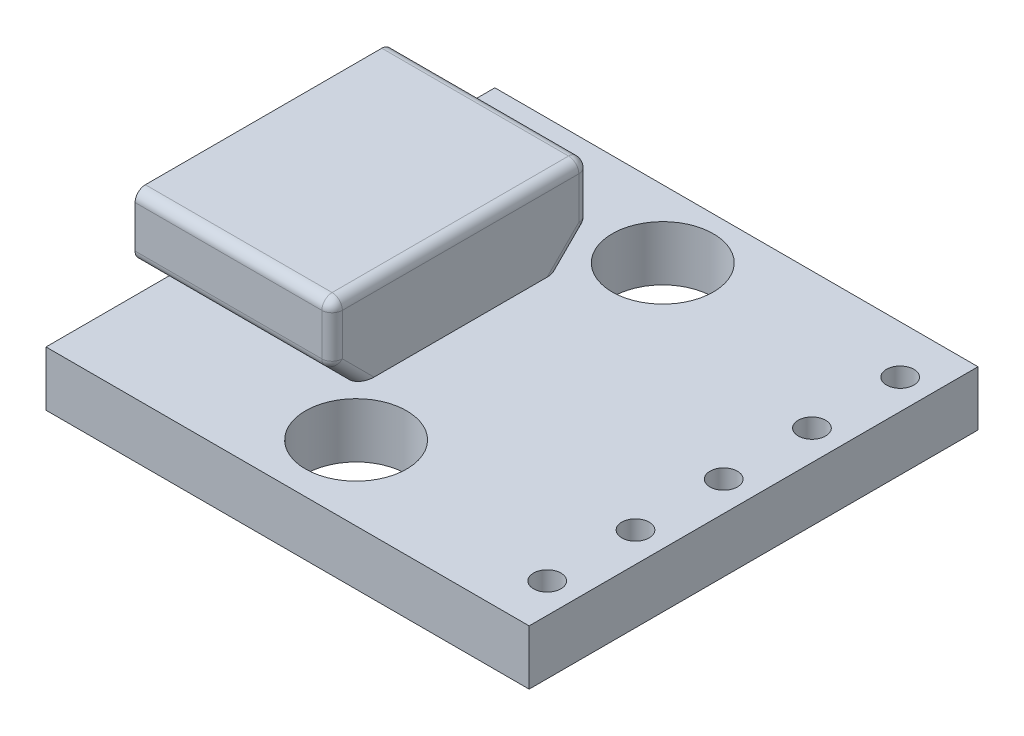
from build123d import *

# Parameters (mm, degrees)
ESQUISSE1_W             = 14.1
ESQUISSE1_H             = 13.1
ESQUISSE1_R             = 1.475
ESQUISSE1_R_2           = 0.4
BOSS_EXTRU_1_DEPTH      = 1.6
ESQUISSE2_W             = 5.75
ESQUISSE2_H             = 7.5
BOSS_EXTRU_2_DEPTH      = 2.45
ENL_V_MAT_EXTRU_1_DEPTH = 5.75
CONG_1_R                = 0.3
ENL_V_MAT_EXTRU_2_DEPTH = 4.5
ESQUISSE5_W             = 3.5
ESQUISSE5_H             = 0.6
BOSS_EXTRU_3_DEPTH      = 3.7


with BuildPart() as part:
    # Esquisse1 → Boss.-Extru.1 (new body)
    with BuildSketch(Plane(origin=(0, 0, 0), x_dir=(1, 0, 0), z_dir=(0, 1, 0))):
        Rectangle(ESQUISSE1_W, ESQUISSE1_H)
        with Locations(Location((-0.175, -4.375, 0), (0, 0, 270))):
            Circle(ESQUISSE1_R, mode=Mode.SUBTRACT)
        with Locations(Location((-0.175, 4.575, 0), (0, 0, 270))):
            Circle(ESQUISSE1_R, mode=Mode.SUBTRACT)
        with Locations(Location((6.178751871, -5.15, 0), (0, 0, 270))):
            Circle(ESQUISSE1_R_2, mode=Mode.SUBTRACT)
        with Locations(Location((6.178751871, -2.575, 0), (0, 0, 270))):
            Circle(ESQUISSE1_R_2, mode=Mode.SUBTRACT)
        with Locations(Location((6.178751871, 0, 0), (0, 0, 270))):
            Circle(ESQUISSE1_R_2, mode=Mode.SUBTRACT)
        with Locations(Location((6.178751871, 2.575, 0), (0, 0, 270))):
            Circle(ESQUISSE1_R_2, mode=Mode.SUBTRACT)
        with Locations(Location((6.178751871, 5.15, 0), (0, 0, 270))):
            Circle(ESQUISSE1_R_2, mode=Mode.SUBTRACT)
    extrude(amount=BOSS_EXTRU_1_DEPTH)

    # Esquisse2 → Boss.-Extru.2 (add)
    with BuildSketch(Plane(origin=(0, 1.6, 0), x_dir=(1, 0, 0), z_dir=(0, 1, 0))):
        with Locations((-4.375, 0)):
            Rectangle(ESQUISSE2_W, ESQUISSE2_H)
    extrude(amount=BOSS_EXTRU_2_DEPTH)

    # Esquisse3 → Enlèv. mat.-Extru.1 (cut)
    with BuildSketch(Plane.ZY.offset(7.25)):
        Polygon((-3.75, 1.6), (-2.95, 1.6), (-3.75, 2.4), align=None)
        Polygon((2.95, 1.6), (3.75, 1.6), (3.75, 2.4), align=None)
    extrude(amount=-ENL_V_MAT_EXTRU_1_DEPTH, mode=Mode.SUBTRACT)

    # Congé1
    cong_1_edges = [part.edges().sort_by_distance(p)[0] for p in [
        (-1.5, 2, 3.35),
        (-1.5, 3.225, 3.75),
        (-1.5, 2, -3.35),
        (-1.5, 3.225, -3.75),
        (-1.5, 4.05, 0),
        (-7.15, 1.6, 2.95),
        (-7.15, 1.6, -2.95),
        (-4.375, 2.4, -3.75),
        (-4.375, 2.4, 3.75),
        (-4.375, 4.05, -3.75),
        (-4.375, 4.05, 3.75),
    ]]
    fillet(cong_1_edges, radius=CONG_1_R)

    # Esquisse4 → Enlèv. mat.-Extru.2 (cut)
    with BuildSketch(Plane.ZY.offset(7.25)):
        Polygon((-3.53, 3.83), (-3.53, 2.491126984), (-2.858873016, 1.82), (2.858873016, 1.82), (3.53, 2.491126984), (3.53, 3.83), align=None)
    extrude(amount=-ENL_V_MAT_EXTRU_2_DEPTH, mode=Mode.SUBTRACT)

    # Esquisse5 → Boss.-Extru.3 (add)
    with BuildSketch(Plane.ZY.offset(2.75)):
        with Locations((0, 2.83)):
            Rectangle(ESQUISSE5_W, ESQUISSE5_H)
    extrude(amount=BOSS_EXTRU_3_DEPTH)


solid = part.part
